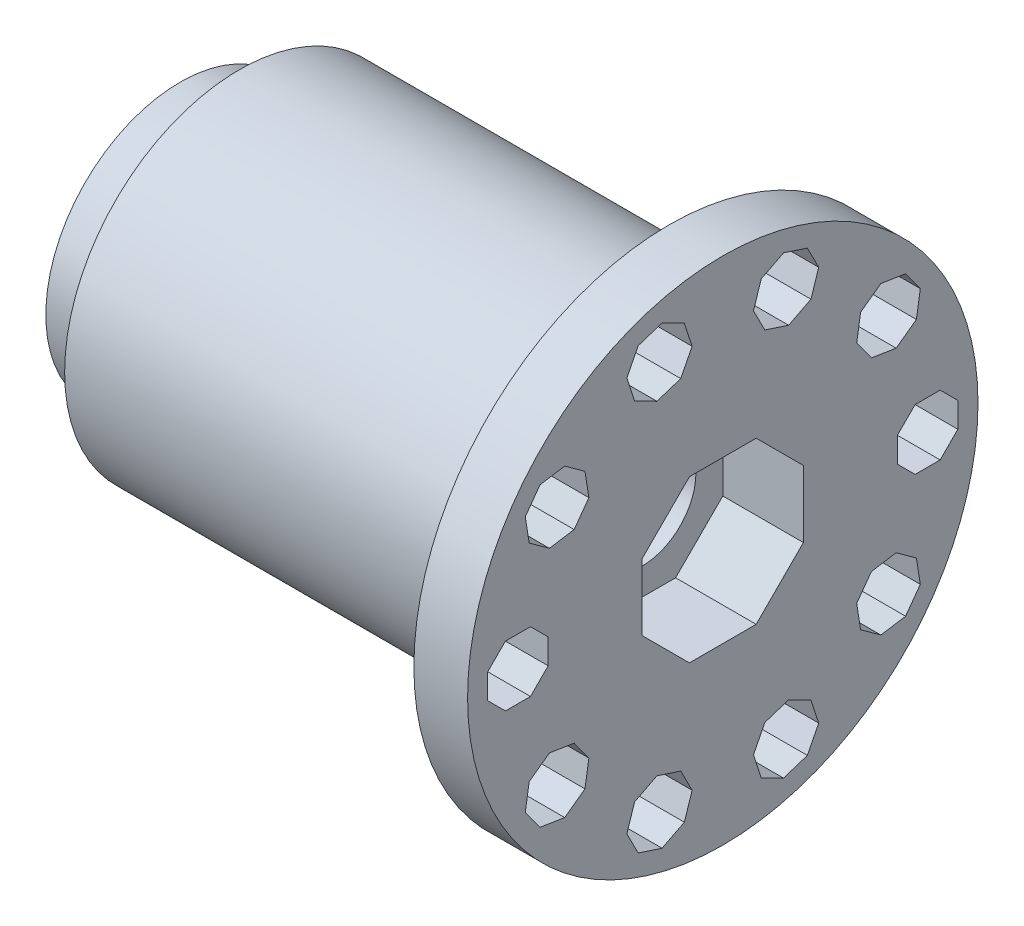
from build123d import *

# Parameters (mm, degrees)
CORTAR_EXTRUIR1_DEPTH = 6
CORTAR_EXTRUIR2_DEPTH = 4
MATRIZC1_COUNT        = 10
CROQUIS4_R            = 4
CORTAR_EXTRUIR3_DEPTH = 44.650429551


with BuildPart() as part:
    # Croquis1 → Revolución1 (revolve)
    with BuildSketch(Plane(origin=(0, 0, 0), x_dir=(0, 1, 0), z_dir=(0, 0, 1)), mode=Mode.PRIVATE) as revoluci_n1_sk:
        Polygon((0, 0), (19, 0), (19, 4), (13, 4), (13, 36), (10, 36), (10, 40.4), (0, 40.4), align=None)
    revolve(revoluci_n1_sk.sketch.rotate(Axis((0, 0, 0), (-1, 0, 0)), 90), axis=Axis((0, 0, 0), (-1, 0, 0)))

    # Croquis2 → Cortar-Extruir1 (cut)
    with BuildSketch(Plane.YZ):
        Polygon((2.485281374, -6), (6, -2.485281374), (6, 2.485281374), (2.485281374, 6), (-2.485281374, 6), (-6, 2.485281374), (-6, -2.485281374), (-2.485281374, -6), align=None)
    cortar_extruir1 = extrude(amount=-CORTAR_EXTRUIR1_DEPTH, mode=Mode.SUBTRACT)

    # Simetría1: Cortar-Extruir1 across plane
    add(cortar_extruir1.mirror(Plane(origin=(-20.2, 0, 0), x_dir=(0, 0, 1), z_dir=(1, 0, 0))), mode=Mode.SUBTRACT)

    # Croquis3 → Cortar-Extruir2 (cut)
    with BuildSketch(Plane.YZ):
        Polygon((2.25, 14.318019485), (2.25, 16.181980515), (0.931980515, 17.5), (-0.931980515, 17.5), (-2.25, 16.181980515), (-2.25, 14.318019485), (-0.931980515, 13), (0.931980515, 13), align=None)
    cortar_extruir2 = extrude(amount=-CORTAR_EXTRUIR2_DEPTH, mode=Mode.SUBTRACT)

    # MatrizC1: Cortar-Extruir2 ×10 about axis
    matrizc1_axis = Axis((0, 0, 0), (1, 0, 0))
    for i in range(1, MATRIZC1_COUNT):
        add(cortar_extruir2.rotate(matrizc1_axis, i * 360 / MATRIZC1_COUNT), mode=Mode.SUBTRACT)

    # Croquis4 → Cortar-Extruir3 (cut, through all)
    with BuildSketch(Plane.YZ.offset(-6)):
        with Locations(Location((0, 0, 0), (0, 0, 270))):
            Circle(CROQUIS4_R)
    extrude(amount=-CORTAR_EXTRUIR3_DEPTH, mode=Mode.SUBTRACT)


solid = part.part
